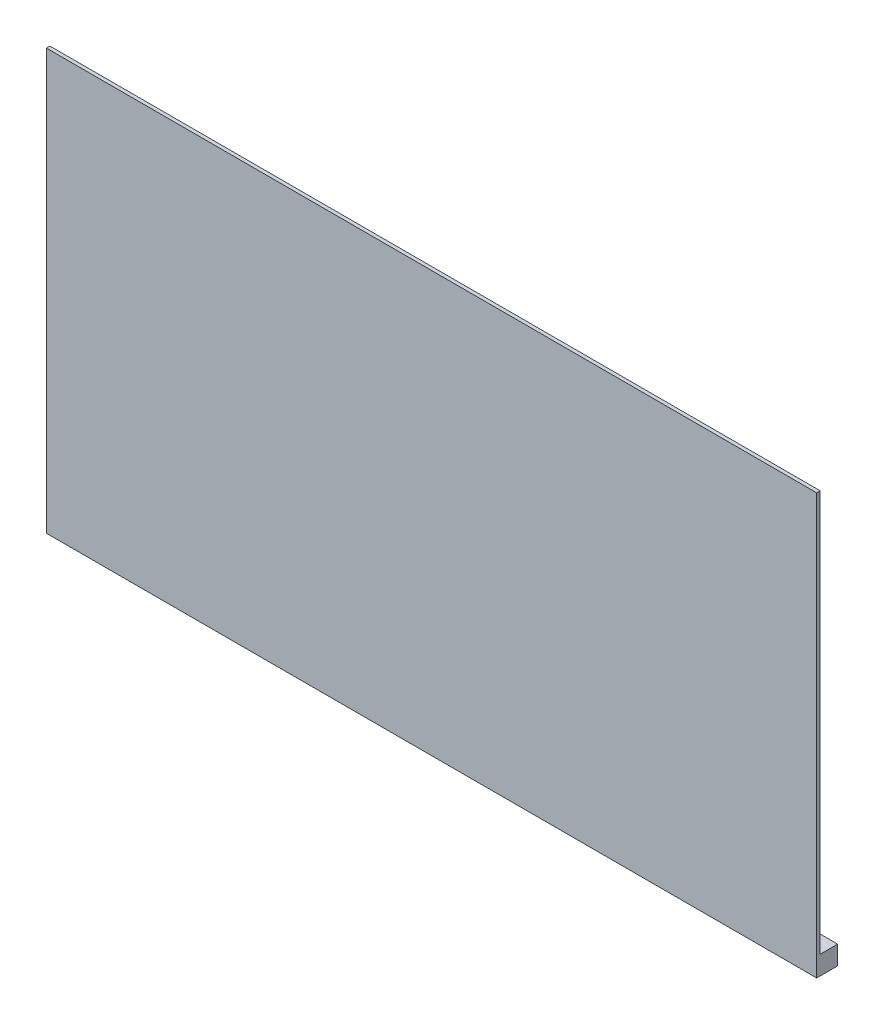
from build123d import *

# Parameters (mm, degrees)
SKETCH_1_W      = 4400
SKETCH_1_H      = 2400
EXTRUDE_1_DEPTH = 10
SKETCH_2_W      = 4400
SKETCH_2_H      = 107.668061123
EXTRUDE_2_DEPTH = 100


with BuildPart() as part:
    # Эскиз1 → Бобышка-Вытянуть1 (new, symmetric)
    with BuildSketch(Plane.XY):
        with Locations((6600, -7800)):
            Rectangle(SKETCH_1_W, SKETCH_1_H)
    extrude(amount=EXTRUDE_1_DEPTH, both=True)

    # Эскиз2 → Бобышка-Вытянуть2 (add)
    with BuildSketch(Plane(origin=(0, 0, -10), x_dir=(-1, 0, 0), z_dir=(0, 0, -1))):
        with Locations((-6600, -8946.165969439)):
            Rectangle(SKETCH_2_W, SKETCH_2_H)
    extrude(amount=EXTRUDE_2_DEPTH)


solid = part.part
